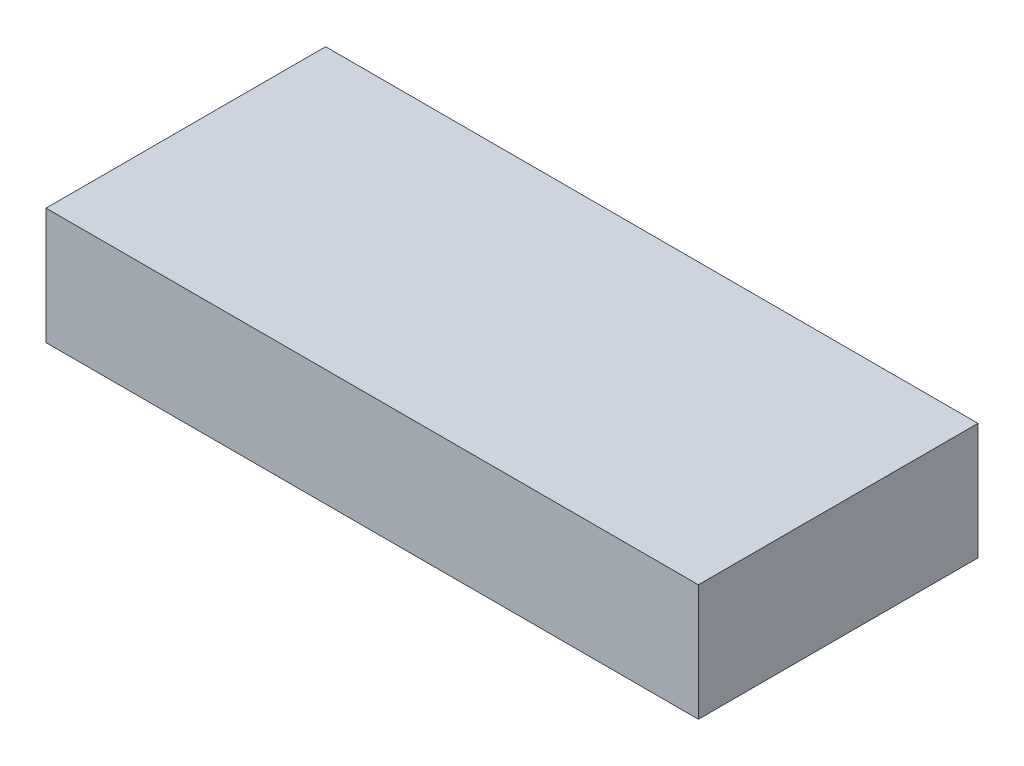
from build123d import *

# Parameters (mm, degrees)
SKETCH1_W           = 280
SKETCH1_H           = 120
BOSS_EXTRUDE1_DEPTH = 25


with BuildPart() as part:
    # Sketch1 → Boss-Extrude1 (new, symmetric)
    with BuildSketch(Plane(origin=(0, 0, 0), x_dir=(1, 0, 0), z_dir=(0, 1, 0))):
        Rectangle(SKETCH1_W, SKETCH1_H)
    extrude(amount=BOSS_EXTRUDE1_DEPTH, both=True)


solid = part.part
